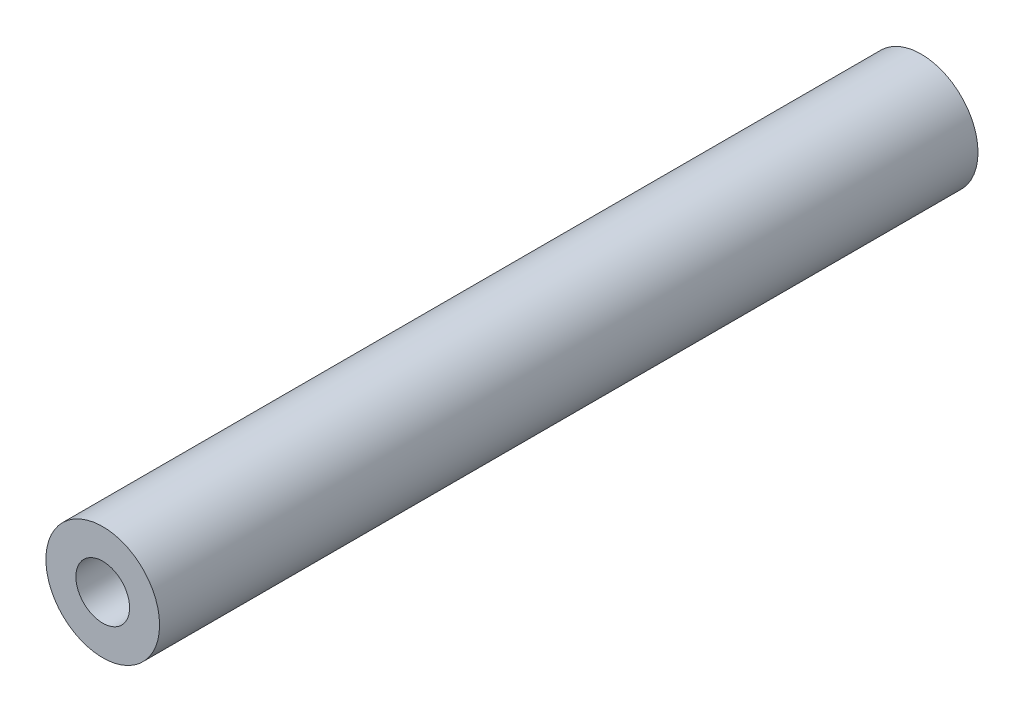
from build123d import *

# Parameters (mm, degrees)
SKETCH1_R           = 3.175
SKETCH1_R_2         = 1.5
BOSS_EXTRUDE1_DEPTH = 45.72


with BuildPart() as part:
    # Sketch1 → Boss-Extrude1 (new body)
    with BuildSketch(Plane.XY):
        Circle(SKETCH1_R)
        Circle(SKETCH1_R_2, mode=Mode.SUBTRACT)
    extrude(amount=BOSS_EXTRUDE1_DEPTH)


solid = part.part
